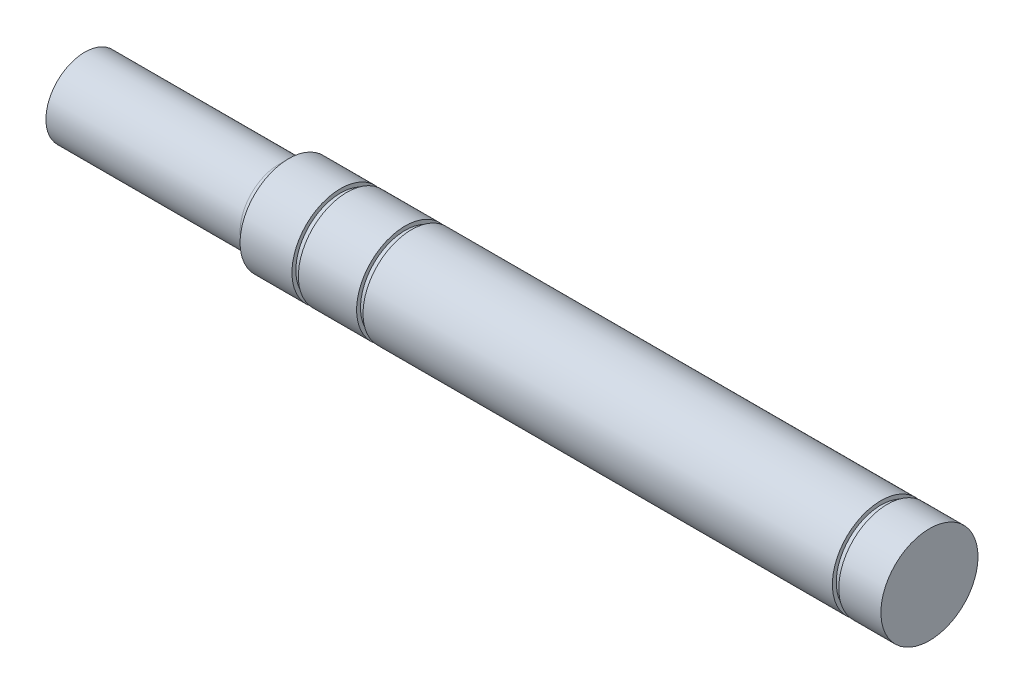
from build123d import *


with BuildPart() as part:
    # Sketch1 → Revolve1 (revolve)
    with BuildSketch(Plane(origin=(0, 0, 0), x_dir=(-1, 0, 0), z_dir=(0, 0, 1)), mode=Mode.PRIVATE) as revolve1_sk:
        with BuildLine():
            Line((93.245668053, 287.354869365), (93.245668053, 287.754869365))
            Line((93.245668053, 287.754869365), (87.245668053, 287.754869365))
            Line((87.245668053, 287.754869365), (87.245668053, 287.354869365))
            Line((87.245668053, 287.354869365), (86.585668053, 287.354869365))
            Line((86.585668053, 287.354869365), (86.585668053, 287.754869365))
            Line((86.585668053, 287.754869365), (38.245668053, 287.754869365))
            Line((38.245668053, 287.754869365), (38.245668053, 287.354869365))
            Line((38.245668053, 287.354869365), (37.585668053, 287.354869365))
            Line((37.585668053, 287.354869365), (37.585668053, 287.754869365))
            Line((37.585668053, 287.754869365), (33.245668053, 287.754869365))
            Line((33.245668053, 287.754869365), (33.245668053, 282.754869365))
            Line((33.245668053, 282.754869365), (120.245668053, 282.754869365))
            Line((120.245668053, 282.754869365), (120.245668053, 286.754869365))
            Line((120.245668053, 286.754869365), (100.245668053, 286.754869365))
            ThreePointArc((100.245668053, 286.754869365), (99.538561272, 287.047762584), (99.245668053, 287.754869365))
            Line((99.245668053, 287.754869365), (93.905668053, 287.754869365))
            Line((93.905668053, 287.754869365), (93.905668053, 287.354869365))
            Line((93.905668053, 287.354869365), (93.245668053, 287.354869365))
        make_face()
    revolve(revolve1_sk.sketch.rotate(Axis((-33.245668053, -282.754869365, 0), (-1, 0, 0)), 270), axis=Axis((-33.245668053, -282.754869365, 0), (-1, 0, 0)))


solid = part.part
